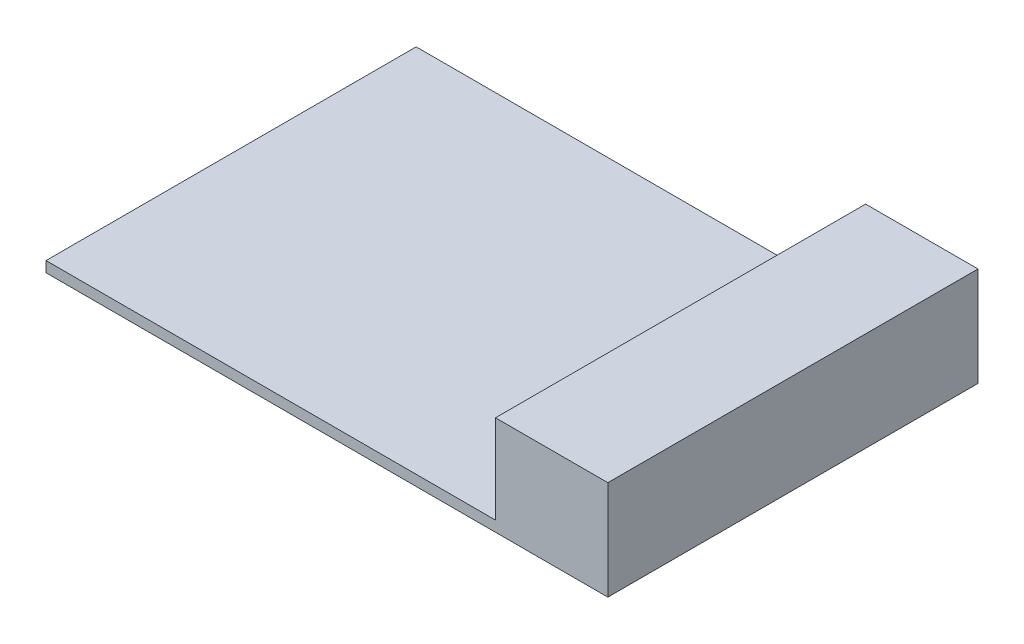
from build123d import *

# Parameters (mm, degrees)
SKETCH1_W           = 85
SKETCH1_H           = 56
BOSS_EXTRUDE1_DEPTH = 1.6
SKETCH2_W           = 17
SKETCH2_H           = 56
BOSS_EXTRUDE2_DEPTH = 15


with BuildPart() as part:
    # Sketch1 → Boss-Extrude1 (new body)
    with BuildSketch(Plane(origin=(0, 0, 0), x_dir=(1, 0, 0), z_dir=(0, 1, 0))):
        Rectangle(SKETCH1_W, SKETCH1_H)
    extrude(amount=BOSS_EXTRUDE1_DEPTH)

    # Sketch2 → Boss-Extrude2 (add)
    with BuildSketch(Plane(origin=(0, 0, 0), x_dir=(1, 0, 0), z_dir=(0, 1, 0))):
        with Locations((34, 0)):
            Rectangle(SKETCH2_W, SKETCH2_H)
    extrude(amount=BOSS_EXTRUDE2_DEPTH)


solid = part.part
